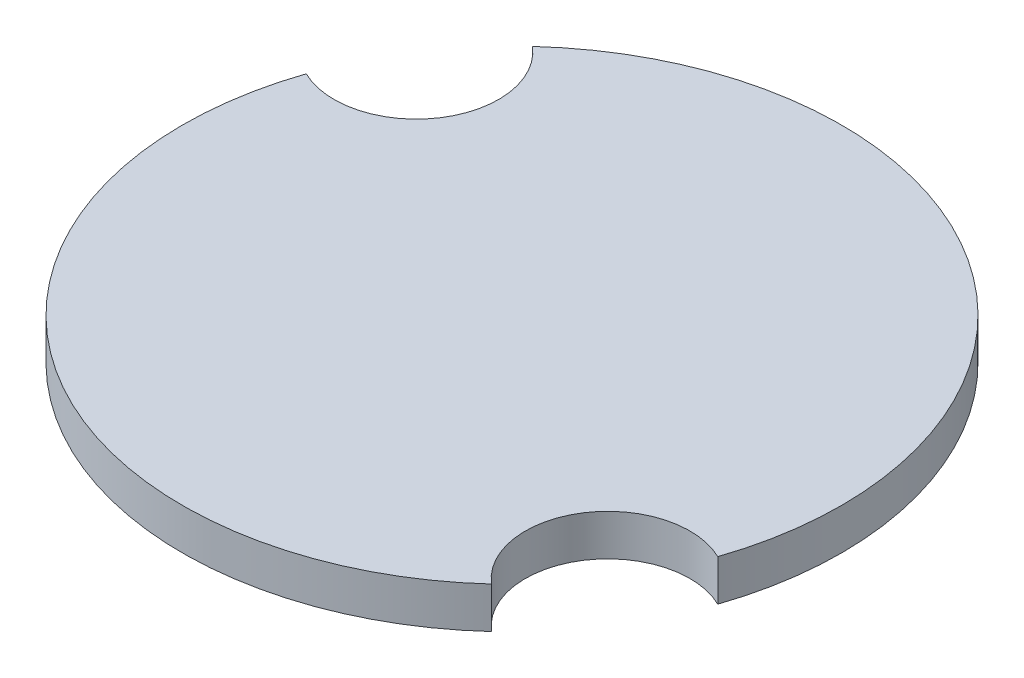
from build123d import *

# Parameters (mm, degrees)
SKETCH_1_R          = 40
EXTRUDE_1_DEPTH     = 5
SKETCH_3D_1_R       = 10
CUT_EXTRUDE_1_DEPTH = 16


with BuildPart() as part:
    # 草图1 → 凸台-拉伸1 (new body)
    with BuildSketch(Plane(origin=(0, 0, 0), x_dir=(1, 0, 0), z_dir=(0, 1, 0))):
        with Locations(Location((27.514936432, -26.415940822, 0), (0, 0, 270))):
            Circle(SKETCH_1_R)
    extrude(amount=EXTRUDE_1_DEPTH)

    # Sketch 3D_1 → 切除-拉伸1 (cut)
    with BuildSketch(Plane(origin=(-5.971827741, 5, 4.538175277), x_dir=(0.8371691043312224, 0, 0.5469441386039886), z_dir=(0, -1, 0))):
        Circle(SKETCH_3D_1_R)
        with Locations((80, 0)):
            Circle(SKETCH_3D_1_R)
    extrude(amount=CUT_EXTRUDE_1_DEPTH, mode=Mode.SUBTRACT)


solid = part.part
